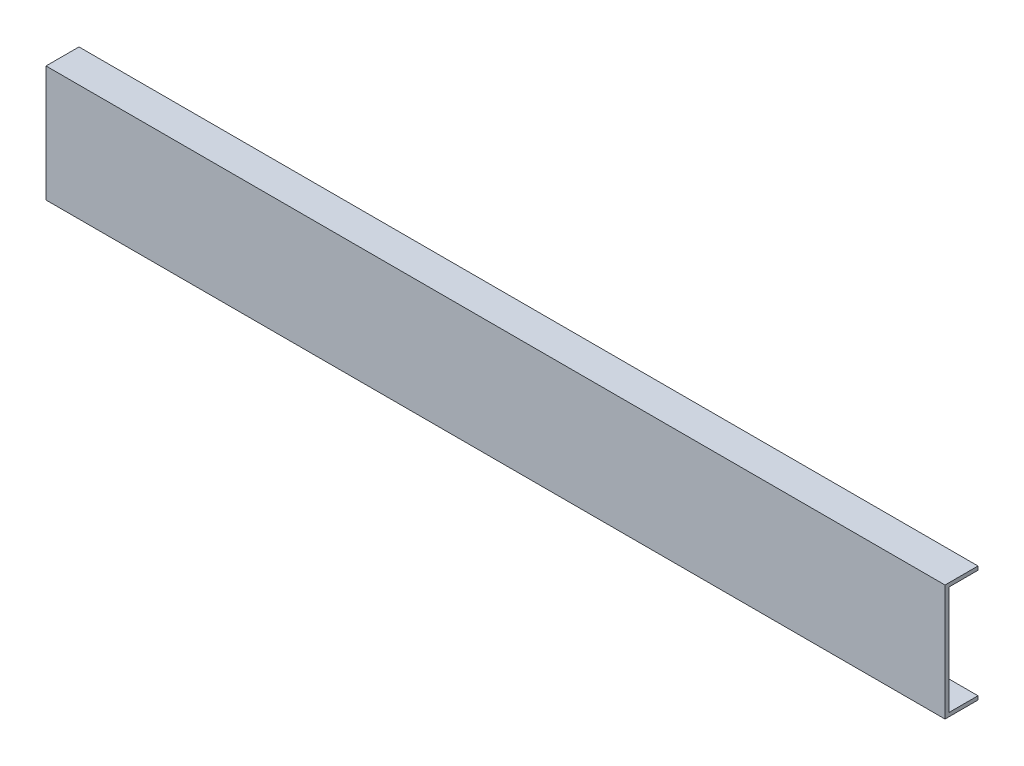
from build123d import *

# Parameters (mm, degrees)
SKETCH2_W           = 609.6
SKETCH2_H           = 78.74
BOSS_EXTRUDE1_DEPTH = 22.352
SKETCH3_W           = 19.812
SKETCH3_H           = 73.66
CUT_EXTRUDE1_DEPTH  = 616.070532138


with BuildPart() as part:
    # Sketch2 → Boss-Extrude1 (new body)
    with BuildSketch(Plane.XY):
        with Locations((304.8, 39.37)):
            Rectangle(SKETCH2_W, SKETCH2_H)
    extrude(amount=BOSS_EXTRUDE1_DEPTH)

    # Sketch3 → Cut-Extrude1 (cut, through all)
    with BuildSketch(Plane(origin=(609.6, 0, 0), x_dir=(0, 0, -1), z_dir=(1, 0, 0))):
        with Locations((-9.906, 39.37)):
            Rectangle(SKETCH3_W, SKETCH3_H)
    extrude(amount=-CUT_EXTRUDE1_DEPTH, mode=Mode.SUBTRACT)


solid = part.part
